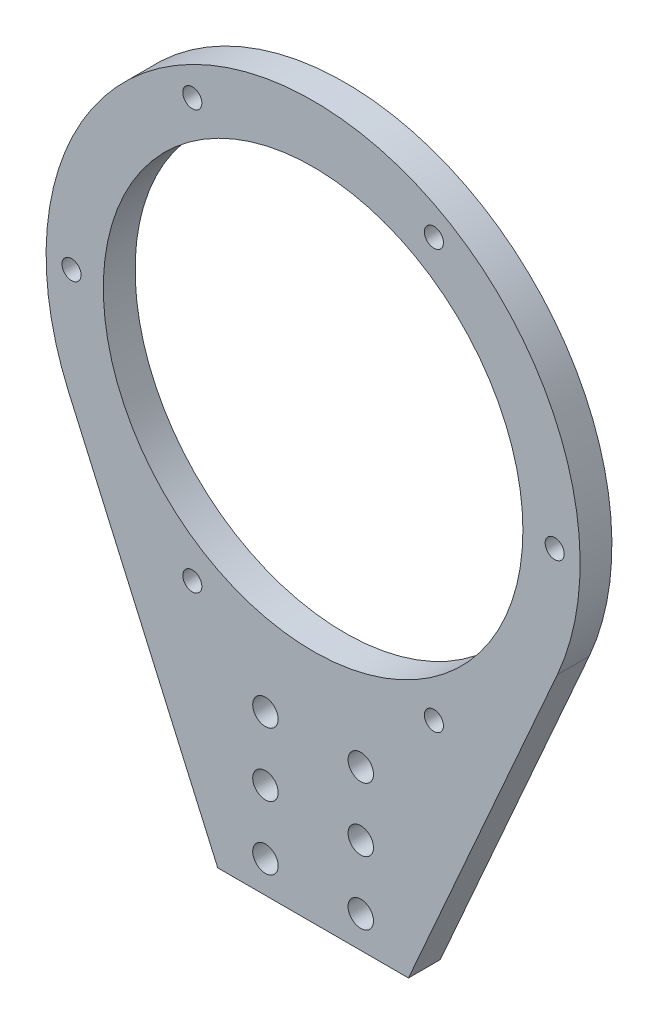
from build123d import *

# Parameters (mm, degrees)
SKETCH1_R           = 42
SKETCH1_R_2         = 33
BOSS_EXTRUDE1_DEPTH = 5
SKETCH9_R           = 1.5
CUT_EXTRUDE5_DEPTH  = 7
SKETCH10_R          = 2
CUT_EXTRUDE6_DEPTH  = 7


with BuildPart() as part:
    # Sketch1 → Boss-Extrude1 (new body)
    # profile 1 of 2: a face of its own
    with BuildSketch(Plane.XY):
        Circle(SKETCH1_R)
        Circle(SKETCH1_R_2, mode=Mode.SUBTRACT)
    # profile 2 of 2: a face of its own
    with BuildSketch(Plane.XY):
        with BuildLine():
            Line((-15, -70), (15, -70))
            Line((15, -70), (38.420282645, -16.96708229))
            ThreePointArc((38.420282645, -16.96708229), (0, -42), (-38.420282645, -16.96708229))
            Line((-38.420282645, -16.96708229), (-15, -70))
        make_face()
    extrude(amount=BOSS_EXTRUDE1_DEPTH)

    # Sketch9 → Cut-Extrude5 (cut)
    with BuildSketch(Plane.XY.offset(5)):
        with Locations((19, 32.908965344)):
            Circle(SKETCH9_R)
        with Locations((38, 0)):
            Circle(SKETCH9_R)
        with Locations((19, -32.908965344)):
            Circle(SKETCH9_R)
        with Locations((-19, -32.908965344)):
            Circle(SKETCH9_R)
        with Locations((-38, 0)):
            Circle(SKETCH9_R)
        with Locations((-19, 32.908965344)):
            Circle(SKETCH9_R)
    extrude(amount=-CUT_EXTRUDE5_DEPTH, mode=Mode.SUBTRACT)

    # Sketch10 → Cut-Extrude6 (cut)
    with BuildSketch(Plane.XY.offset(5)):
        with Locations((7.5, -55)):
            Circle(SKETCH10_R)
        with Locations((7.5, -65)):
            Circle(SKETCH10_R)
        with Locations((-7.5, -65)):
            Circle(SKETCH10_R)
        with Locations((-7.5, -55)):
            Circle(SKETCH10_R)
        with Locations((-7.5, -45)):
            Circle(SKETCH10_R)
        with Locations((7.5, -45)):
            Circle(SKETCH10_R)
    extrude(amount=-CUT_EXTRUDE6_DEPTH, mode=Mode.SUBTRACT)


solid = part.part
